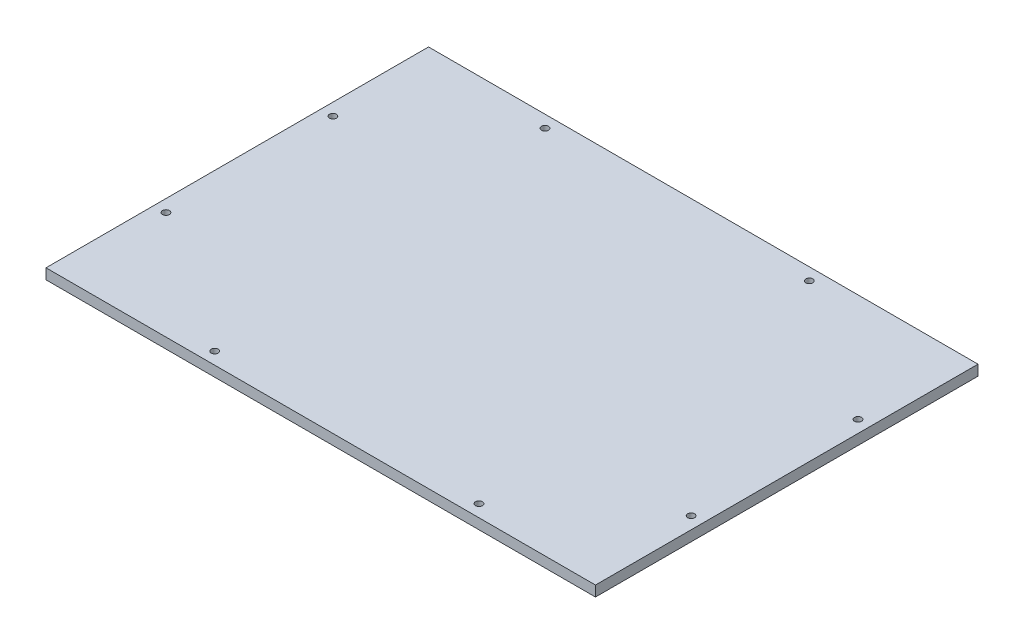
from build123d import *

# Parameters (mm, degrees)
SKETCH1_W           = 501.65
SKETCH1_H           = 349.25
BOSS_EXTRUDE1_DEPTH = 9.525
SKETCH2_R           = 3.175
CUT_EXTRUDE1_DEPTH  = 9.525


with BuildPart() as part:
    # Sketch1 → Boss-Extrude1 (new body)
    with BuildSketch(Plane(origin=(0, 0, 0), x_dir=(1, 0, 0), z_dir=(0, 1, 0))):
        with Locations((259.3132527, -174.625)):
            Rectangle(SKETCH1_W, SKETCH1_H)
    extrude(amount=BOSS_EXTRUDE1_DEPTH)

    # Sketch2 → Cut-Extrude1 (cut)
    with BuildSketch(Plane(origin=(0, 9.525, 0), x_dir=(1, 0, 0), z_dir=(0, 1, 0))):
        with Locations(Location((392.6632527, -338.1375, 0), (0, 0, 270))):
            Circle(SKETCH2_R)
        with Locations(Location((151.3632527, -338.1375, 0), (0, 0, 270))):
            Circle(SKETCH2_R)
        with Locations(Location((367.2632527, -11.1125, 0), (0, 0, 270))):
            Circle(SKETCH2_R)
        with Locations(Location((125.9632527, -11.1125, 0), (0, 0, 270))):
            Circle(SKETCH2_R)
        with Locations(Location((19.6007527, -250.825, 0), (0, 0, 270))):
            Circle(SKETCH2_R)
        with Locations(Location((19.6007527, -98.425, 0), (0, 0, 270))):
            Circle(SKETCH2_R)
        with Locations(Location((499.0257527, -250.825, 0), (0, 0, 270))):
            Circle(SKETCH2_R)
        with Locations(Location((499.0257527, -98.425, 0), (0, 0, 270))):
            Circle(SKETCH2_R)
    extrude(amount=-CUT_EXTRUDE1_DEPTH, mode=Mode.SUBTRACT)


solid = part.part
